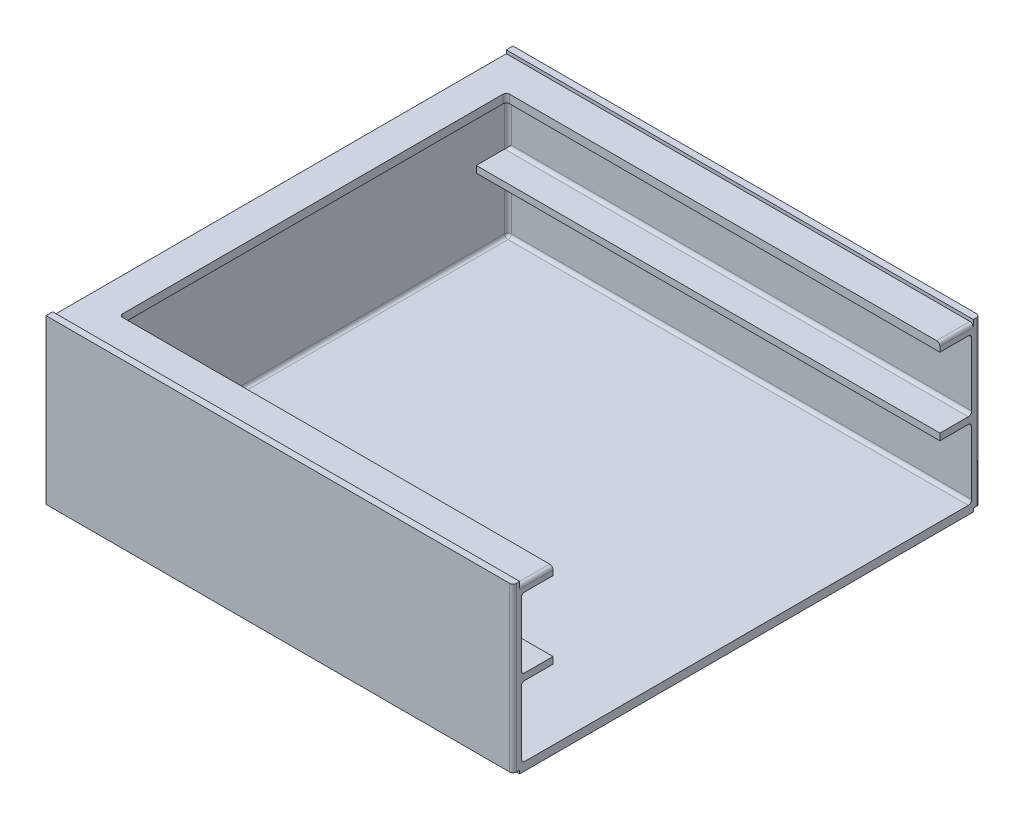
from build123d import *

# Parameters (mm, degrees)
SKETCH_1_W          = 280
SKETCH_1_H          = 280
EXTRUDE_1_DEPTH     = 100
SKETCH_2_W          = 280
SKETCH_2_H          = 272
CUT_EXTRUDE_1_DEPTH = 2
SKETCH_3_W          = 280
SKETCH_3_H          = 4
CUT_EXTRUDE_2_DEPTH = 2
SKETCH_4_W          = 270
SKETCH_4_H          = 88
CUT_EXTRUDE_3_DEPTH = 278
SKETCH_6_W          = 260
SKETCH_6_H          = 232
CUT_EXTRUDE_7_DEPTH = 93
FILLET_4_R          = 2
FILLET_5_R          = 2
FILLET_6_R          = 2
SKETCH_8_W          = 19
SKETCH_8_H          = 4
EXTRUDE_2_DEPTH     = 278
FILLET_7_R          = 2


with BuildPart() as part:
    # 草图1 → 凸台-拉伸1 (new body)
    with BuildSketch(Plane(origin=(0, 0, 0), x_dir=(1, 0, 0), z_dir=(0, 1, 0))):
        Rectangle(SKETCH_1_W, SKETCH_1_H)
    extrude(amount=EXTRUDE_1_DEPTH)

    # 草图2 → 切除-拉伸1 (cut)
    with BuildSketch(Plane(origin=(0, 100, 0), x_dir=(1, 0, 0), z_dir=(0, 1, 0))):
        Rectangle(SKETCH_2_W, SKETCH_2_H)
    extrude(amount=-CUT_EXTRUDE_1_DEPTH, mode=Mode.SUBTRACT)

    # 草图3 → 切除-拉伸2 (cut)
    with BuildSketch(Plane.XZ):
        with Locations((0, 138)):
            Rectangle(SKETCH_3_W, SKETCH_3_H)
        with Locations((0, -138)):
            Rectangle(SKETCH_3_W, SKETCH_3_H)
    extrude(amount=-CUT_EXTRUDE_2_DEPTH, mode=Mode.SUBTRACT)

    # 草图4 → 切除-拉伸3 (cut)
    with BuildSketch(Plane(origin=(140, 0, 0), x_dir=(0, 0, -1), z_dir=(1, 0, 0))):
        with Locations((0, 49)):
            Rectangle(SKETCH_4_W, SKETCH_4_H)
    extrude(amount=-CUT_EXTRUDE_3_DEPTH, mode=Mode.SUBTRACT)

    # 草图6 → 切除-拉伸7 (cut)
    with BuildSketch(Plane(origin=(0, 98, 0), x_dir=(1, 0, 0), z_dir=(0, 1, 0))):
        with Locations((10, 0)):
            Rectangle(SKETCH_6_W, SKETCH_6_H)
    extrude(amount=-CUT_EXTRUDE_7_DEPTH, mode=Mode.SUBTRACT)

    # 圆角4
    fillet_4_edges = [part.edges().sort_by_distance(p)[0] for p in [
        (140, 51, -140),
        (140, 51, 140),
    ]]
    fillet(fillet_4_edges, radius=FILLET_4_R)

    # 圆角5
    fillet_5_edges = [part.edges().sort_by_distance(p)[0] for p in [
        (140, 98, 126),
        (140, 98, -126),
    ]]
    fillet(fillet_5_edges, radius=FILLET_5_R)

    # 圆角6
    fillet_6_edges = [part.edges().sort_by_distance(p)[0] for p in [
        (-120, 95.5, -116),
        (-120, 95.5, 116),
    ]]
    fillet(fillet_6_edges, radius=FILLET_6_R)

    # 草图8 → 凸台-拉伸2 (add)
    with BuildSketch(Plane(origin=(-138, 0, 0), x_dir=(0, 0, -1), z_dir=(1, 0, 0))):
        with Locations((-125.5, 49)):
            Rectangle(SKETCH_8_W, SKETCH_8_H)
        with Locations((125.5, 49)):
            Rectangle(SKETCH_8_W, SKETCH_8_H)
    extrude(amount=EXTRUDE_2_DEPTH)

    # 圆角7
    fillet_7_edges = [part.edges().sort_by_distance(p)[0] for p in [
        (-138, 72, 135),
        (-138, 26, -135),
        (1, 47, 135),
        (1, 51, 135),
        (1, 47, -135),
        (1, 51, -135),
        (1, 5, 135),
        (1, 93, 135),
        (1, 93, -135),
        (1, 5, -135),
        (-138, 26, 135),
        (-138, 93, 0),
        (-138, 72, -135),
        (-138, 5, 0),
    ]]
    fillet(fillet_7_edges, radius=FILLET_7_R)


solid = part.part
